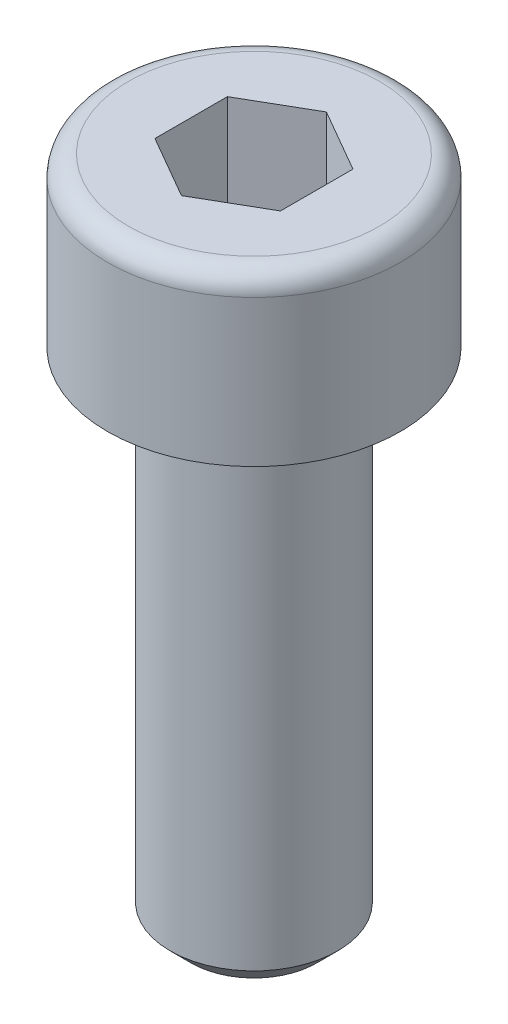
from build123d import *

# Parameters (mm, degrees)
CORTAR_EXTRUIR1_DEPTH = 3
CHAFL_N1_SIZE         = 0.5
REDONDEO1_R           = 0.5


with BuildPart() as part:
    # Croquis1 → Revolución1 (revolve)
    with BuildSketch(Plane.XY, mode=Mode.PRIVATE) as revoluci_n1_sk:
        Polygon((0, 0), (3.5, 0), (3.5, -4), (2, -4), (2, -16), (0, -16), align=None)
    revolve(revoluci_n1_sk.sketch.rotate(Axis((0, 0, 0), (0, -1, 0)), 90), axis=Axis((0, 0, 0), (0, -1, 0)))

    # Croquis2 → Cortar-Extruir1 (cut)
    with BuildSketch(Plane(origin=(0, 0, 0), x_dir=(1, 0, 0), z_dir=(0, 1, 0))):
        Polygon((1.5, 0.866025404), (0, 1.732050808), (-1.5, 0.866025404), (-1.5, -0.866025404), (0, -1.732050808), (1.5, -0.866025404), align=None)
    extrude(amount=-CORTAR_EXTRUIR1_DEPTH, mode=Mode.SUBTRACT)

    # Chaflán1
    chafl_n1_edges = [part.edges().sort_by_distance(p)[0] for p in [
        (0, -16, -2),
    ]]
    chamfer(chafl_n1_edges, length=CHAFL_N1_SIZE)

    # Redondeo1
    redondeo1_edges = [part.edges().sort_by_distance(p)[0] for p in [
        (0, 0, -3.5),
    ]]
    fillet(redondeo1_edges, radius=REDONDEO1_R)


solid = part.part
